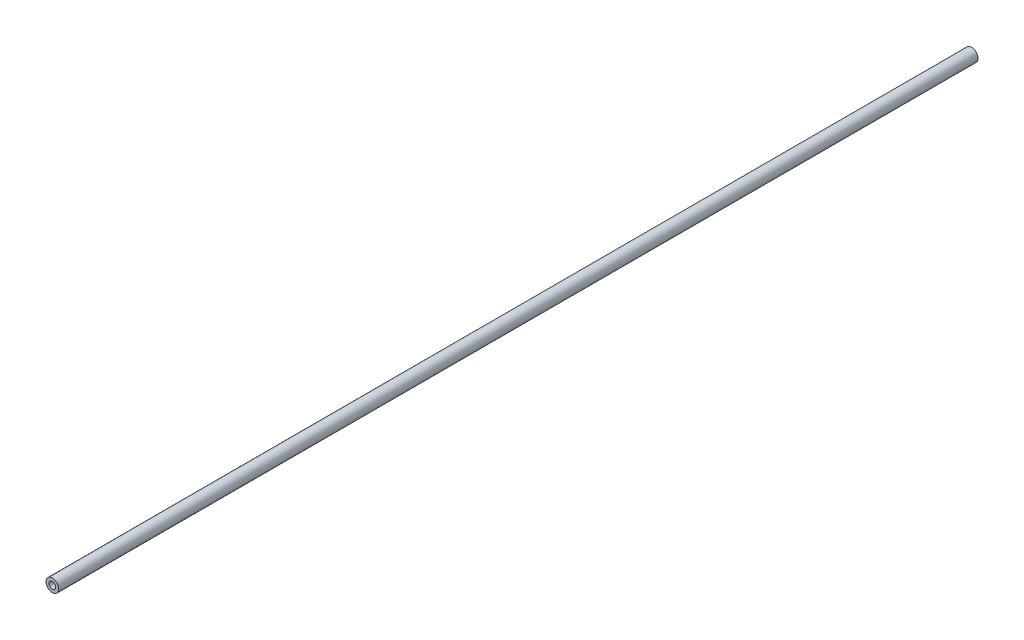
from build123d import *

# Parameters (mm, degrees)
SKETCH1_R           = 4.7625
SKETCH1_R_2         = 2.4892
BOSS_EXTRUDE1_DEPTH = 685.8


with BuildPart() as part:
    # Sketch1 → Boss-Extrude1 (new body)
    with BuildSketch(Plane.XY):
        Circle(SKETCH1_R)
        Circle(SKETCH1_R_2, mode=Mode.SUBTRACT)
    extrude(amount=-BOSS_EXTRUDE1_DEPTH)


solid = part.part
